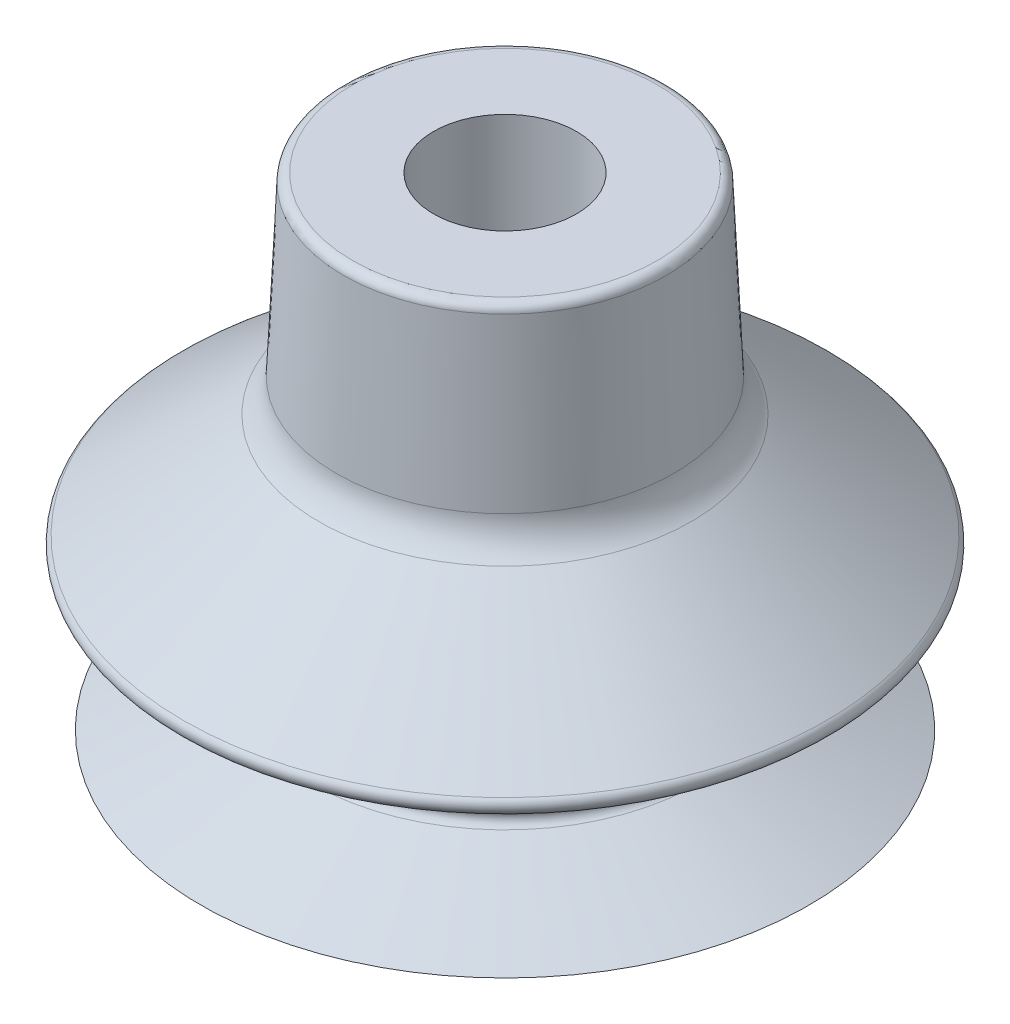
from build123d import *

# Parameters (mm, degrees)
CONG_1_R = 0.5
CONG_2_R = 2.5


with BuildPart() as part:
    # Esquisse1 → Révolution1 (revolve)
    with BuildSketch(Plane.XY, mode=Mode.PRIVATE) as r_volution1_sk:
        Polygon((4, 18), (9, 18), (9.5, 7), (18.5, 0), (10.023859536, -5.822892875), (17, -9), (14.587257075, -9), (8, -6), (16.806816512, 0.050058907), (10.442606536, 5), (4, 5), align=None)
    revolve(r_volution1_sk.sketch.rotate(Axis((0, 0, 0), (0, 1, 0)), 90), axis=Axis((0, 0, 0), (0, 1, 0)))

    # Congé1
    cong_1_edges = [part.edges().sort_by_distance(p)[0] for p in [
        (0, -6, 8),
        (0, -5.822892875, 10.023859536),
        (0, 0, 18.5),
        (0, 18, 9),
        (0, 5, 10.442606536),
        (0, 0.050058907, 16.806816512),
    ]]
    fillet(cong_1_edges, radius=CONG_1_R)

    # Congé2
    cong_2_edges = [part.edges().sort_by_distance(p)[0] for p in [
        (0, 7, 9.5),
    ]]
    fillet(cong_2_edges, radius=CONG_2_R)


solid = part.part
